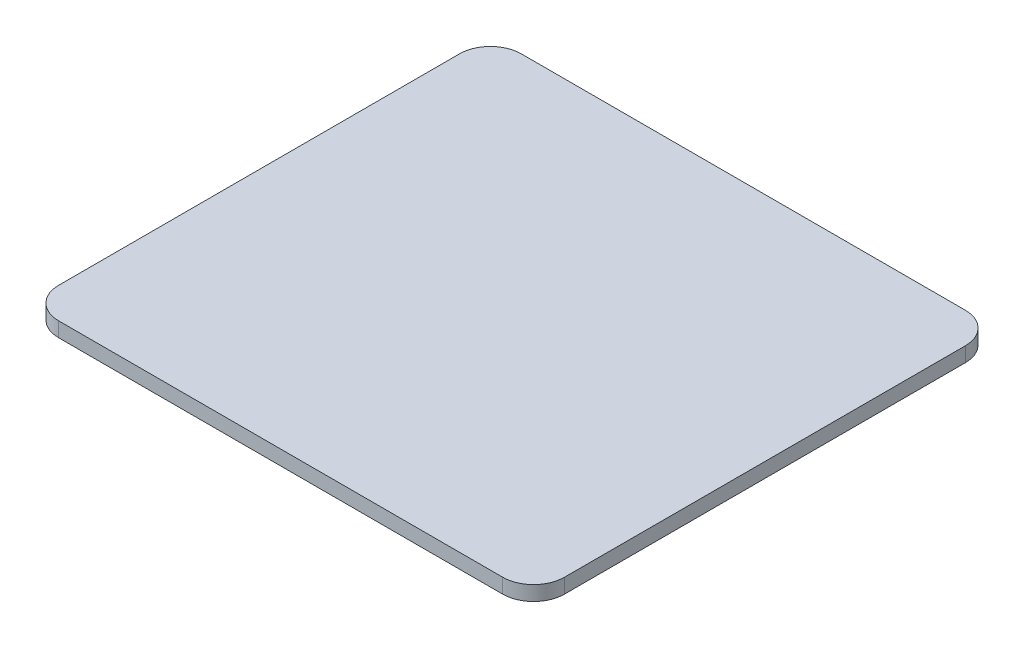
from build123d import *

# Parameters (mm, degrees)
SKETCH1_W           = 164
SKETCH1_H           = 150
BOSS_EXTRUDE1_DEPTH = 4.7625
FILLET1_R           = 10


with BuildPart() as part:
    # Sketch1 → Boss-Extrude1 (new body)
    with BuildSketch(Plane(origin=(0, 0, 0), x_dir=(1, 0, 0), z_dir=(0, 1, 0))):
        Rectangle(SKETCH1_W, SKETCH1_H)
    extrude(amount=BOSS_EXTRUDE1_DEPTH)

    # Fillet1
    fillet1_edges = [part.edges().sort_by_distance(p)[0] for p in [
        (-82, 2.38125, -75),
        (82, 2.38125, -75),
        (82, 2.38125, 75),
        (-82, 2.38125, 75),
    ]]
    fillet(fillet1_edges, radius=FILLET1_R)


solid = part.part
